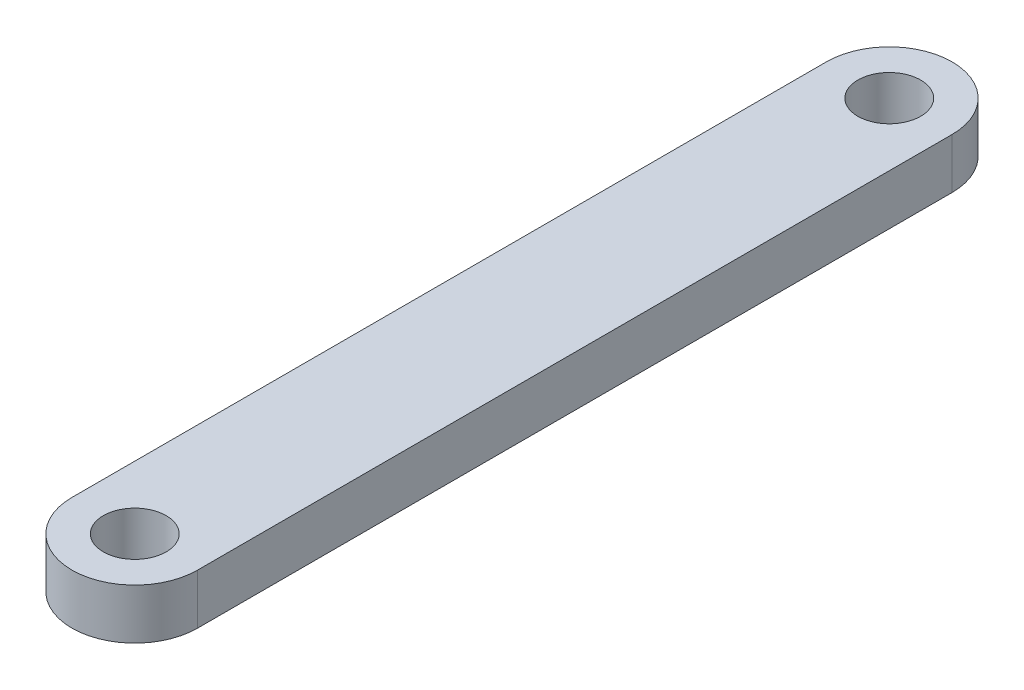
from build123d import *

# Parameters (mm, degrees)
SKETCH1_R           = 1.5875
BOSS_EXTRUDE1_DEPTH = 2.54


with BuildPart() as part:
    # Sketch1 → Boss-Extrude1 (new body)
    with BuildSketch(Plane(origin=(0, 0, 0), x_dir=(1, 0, 0), z_dir=(0, 1, 0))):
        with BuildLine():
            Line((-3.175, 38.099999602), (-3.175, 3.98e-07))
            ThreePointArc((-3.175, 3.98e-07), (0, -3.175), (3.175, 3.98e-07))
            Line((3.175, 3.98e-07), (3.175, 38.099999602))
            ThreePointArc((3.175, 38.099999602), (0, 41.275), (-3.175, 38.099999602))
        make_face()
        with Locations(Location((0, 0, 0), (0, 0, 270))):
            Circle(SKETCH1_R, mode=Mode.SUBTRACT)
        with Locations(Location((0, 38.1, 0), (0, 0, 270))):
            Circle(SKETCH1_R, mode=Mode.SUBTRACT)
    extrude(amount=BOSS_EXTRUDE1_DEPTH)


solid = part.part
